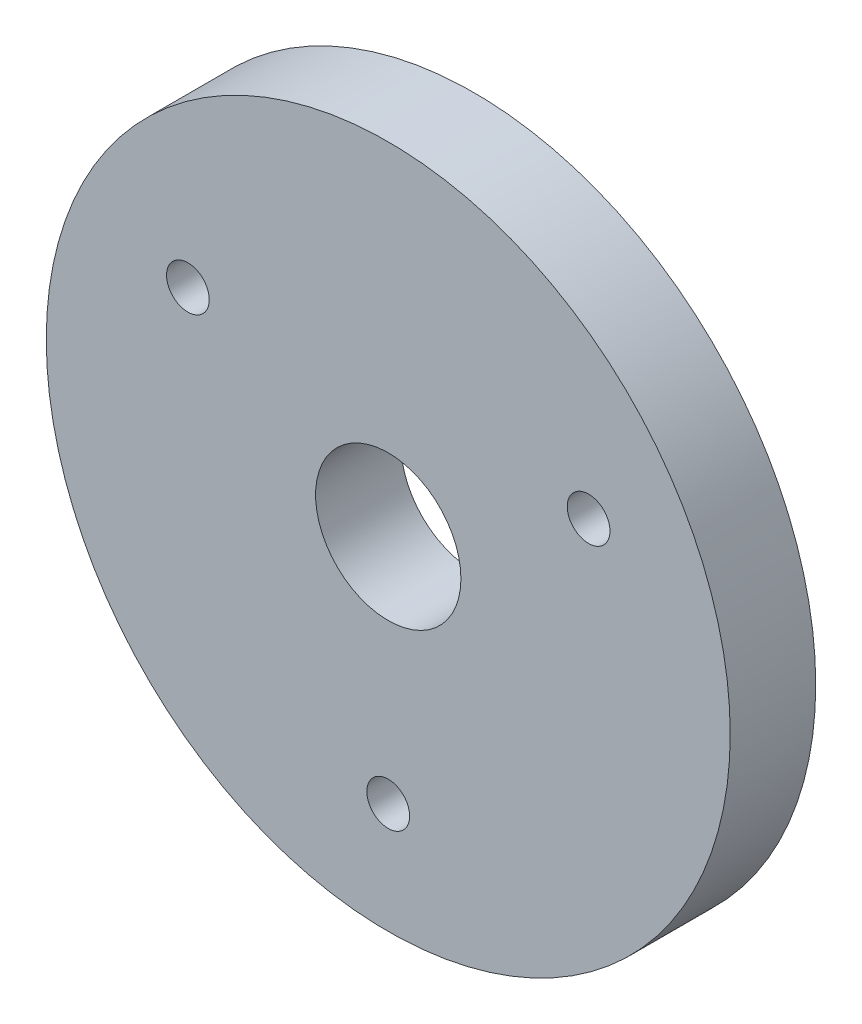
from build123d import *

# Parameters (mm, degrees)
SKETCH_1_R      = 20
SKETCH_1_R_2    = 4.25
SKETCH_1_R_3    = 1.25
EXTRUDE_1_DEPTH = 5


with BuildPart() as part:
    # 草图1 → 凸台-拉伸1 (new body)
    with BuildSketch(Plane.XY):
        Circle(SKETCH_1_R)
        Circle(SKETCH_1_R_2, mode=Mode.SUBTRACT)
        with Locations((0, -13.53)):
            Circle(SKETCH_1_R_3, mode=Mode.SUBTRACT)
        with Locations((-11.717323713, 6.765)):
            Circle(SKETCH_1_R_3, mode=Mode.SUBTRACT)
        with Locations((11.717323713, 6.765)):
            Circle(SKETCH_1_R_3, mode=Mode.SUBTRACT)
    extrude(amount=EXTRUDE_1_DEPTH)


solid = part.part
